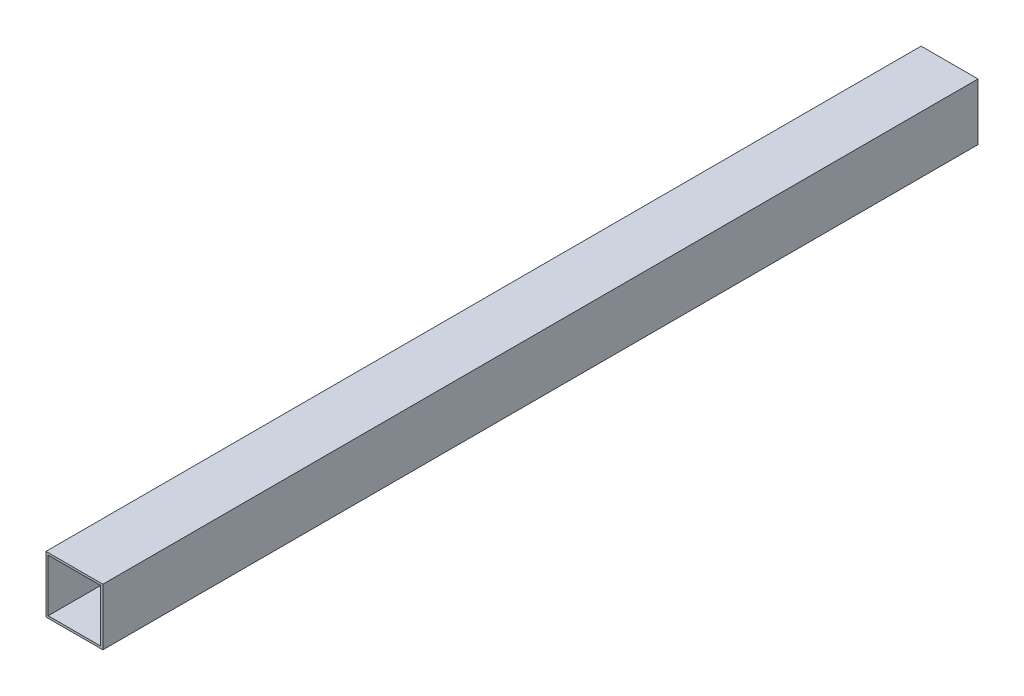
from build123d import *

# Parameters (mm, degrees)
SKETCH1_W           = 13
SKETCH1_H           = 13
SKETCH1_W_2         = 12
SKETCH1_H_2         = 12
BOSS_EXTRUDE1_DEPTH = 200


with BuildPart() as part:
    # Sketch1 → Boss-Extrude1 (new body)
    with BuildSketch(Plane.XY):
        Rectangle(SKETCH1_W, SKETCH1_H)
        Rectangle(SKETCH1_W_2, SKETCH1_H_2, mode=Mode.SUBTRACT)
    extrude(amount=BOSS_EXTRUDE1_DEPTH)


solid = part.part
